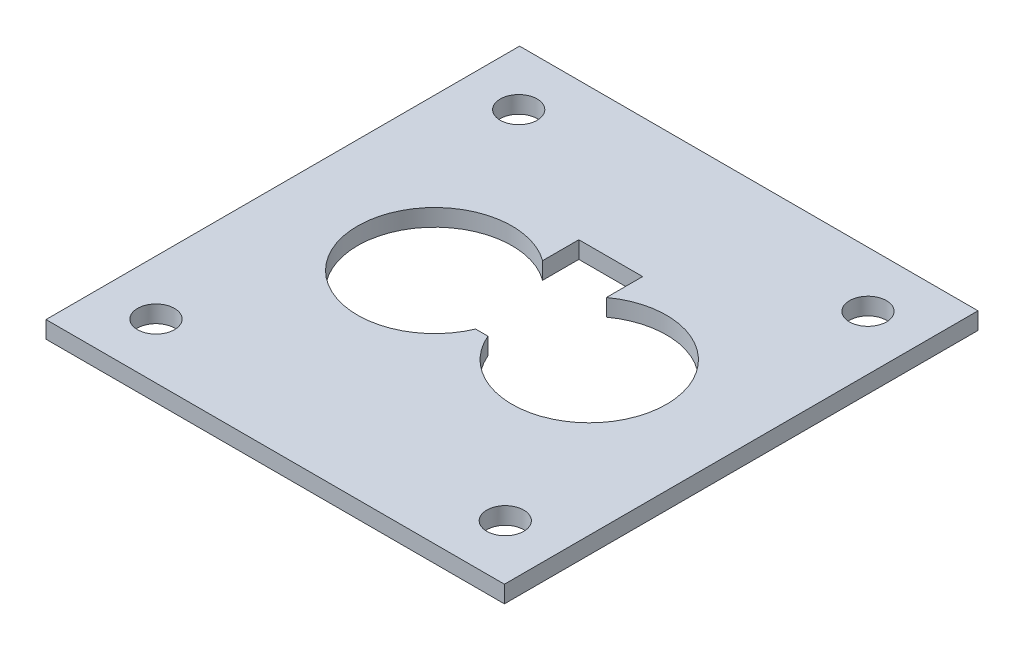
from build123d import *

# Parameters (mm, degrees)
SKETCH1_W            = 68.248659994
SKETCH1_H            = 70.504814042
BOSS_EXTRUDE1_DEPTH  = 2.54
M5_CLEARANCE_HOLE1_D = 5.5
CUT_EXTRUDE1_DEPTH   = 50.128949699


with BuildPart() as part:
    # Sketch1 → Boss-Extrude1 (new body)
    with BuildSketch(Plane(origin=(0, 0, 0), x_dir=(1, 0, 0), z_dir=(0, 1, 0))):
        Rectangle(SKETCH1_W, SKETCH1_H)
    extrude(amount=BOSS_EXTRUDE1_DEPTH)

    # M5 Clearance Hole1 (through all)
    with Locations(Plane(origin=(0, 2.54, 0), x_dir=(1, 0, 0), z_dir=(0, 1, 0))):
        with Locations((26, 27), (-26, 27), (-26, -27), (26, -27)):
            Hole(M5_CLEARANCE_HOLE1_D / 2)

    # Sketch2 → Cut-Extrude1 (cut, through all)
    with BuildSketch(Plane(origin=(0, 2.54, 0), x_dir=(1, 0, 0), z_dir=(0, 1, 0))):
        with BuildLine():
            Line((-4.75, 14.7), (4.75, 14.7))
            Line((4.75, 14.7), (4.75, 9.310612225))
            ThreePointArc((4.75, 9.310612225), (22.581133525, -3.075464159), (0.916994756, -4.5))
            Line((0.916994756, -4.5), (-0.916994756, -4.5))
            ThreePointArc((-0.916994756, -4.5), (-22.581133525, -3.075464159), (-4.75, 9.310612225))
            Line((-4.75, 9.310612225), (-4.75, 14.7))
        make_face()
    extrude(amount=-CUT_EXTRUDE1_DEPTH, mode=Mode.SUBTRACT)


solid = part.part
